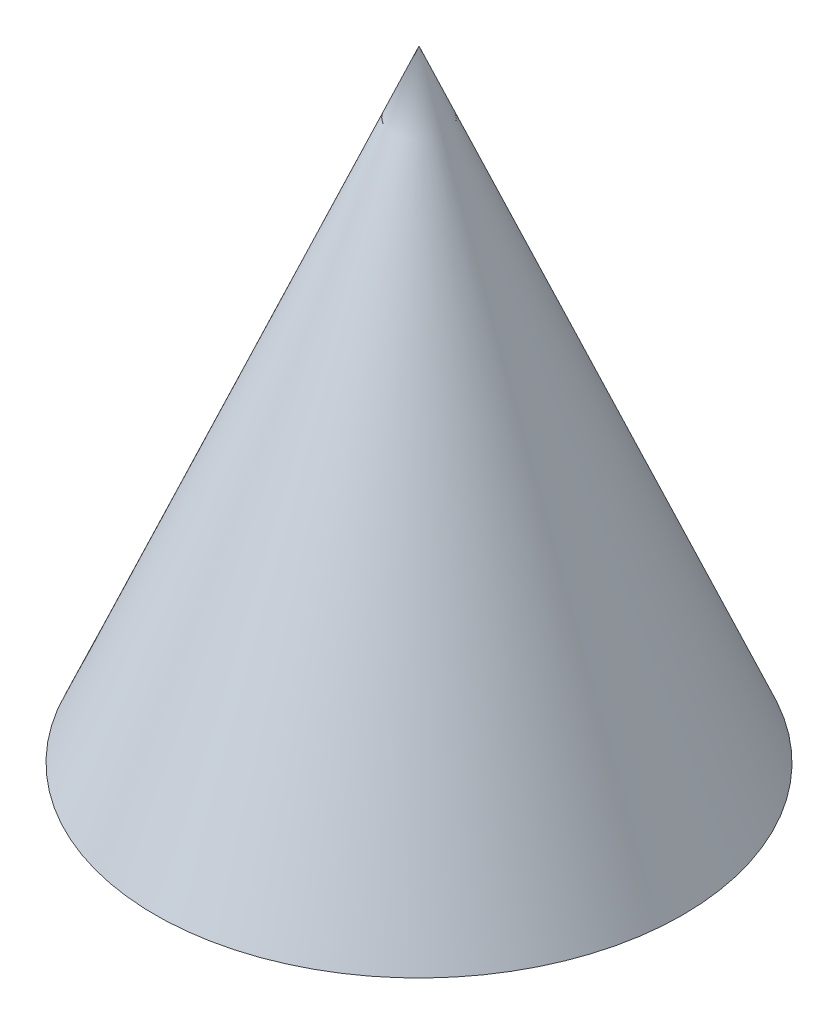
from build123d import *


with BuildPart() as part:
    # Sketch1 → Revolve1 (revolve)
    with BuildSketch(Plane.XY):
        Polygon((0, 0), (1700, 0), (0, 4000), align=None)
    revolve(axis=Axis((0, 4000, 0), (0, -1, 0)))


solid = part.part
